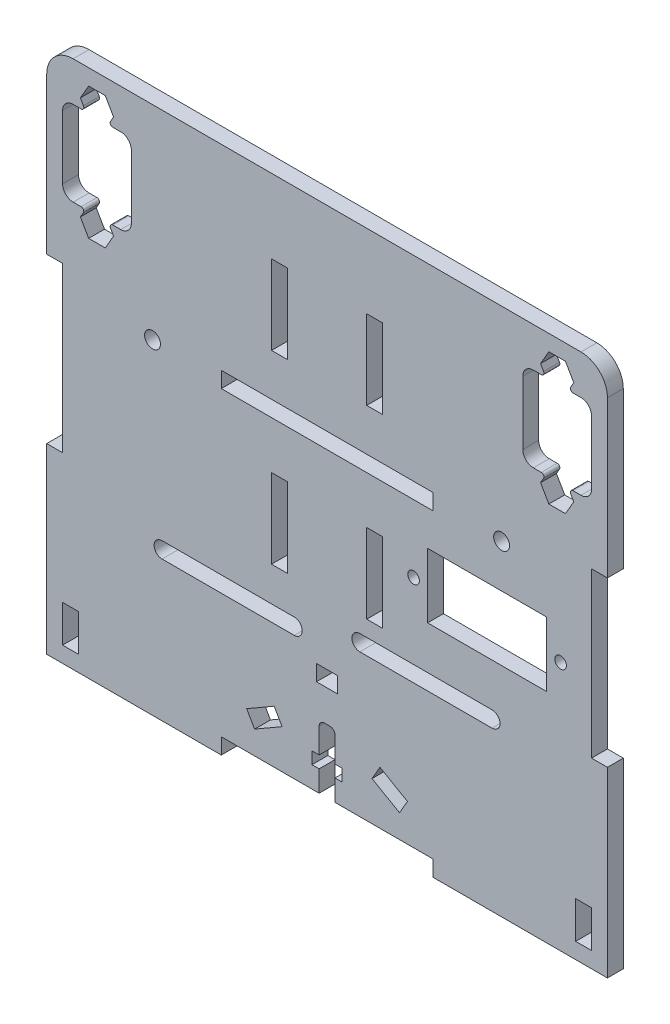
from build123d import *

# Parameters (mm, degrees)
ESBO_O1_W                  = 100
ESBO_O1_H                  = 100
RESSALTO_EXTRUS_O1_DEPTH   = 1.5
ESBO_O2_R                  = 1.5
ESBO_O2_W                  = 40
ESBO_O2_H                  = 3
CORTE_EXTRUS_O1_DEPTH      = 71.774289117
ESBO_O3_W                  = 3
ESBO_O3_H                  = 34.5
RESSALTO_EXTRUS_O2_DEPTH   = 3
CUT_EXTRUDE4_DEPTH         = 73.878323252
CUT_EXTRUDE4_DEPTH_BACK    = 73.878323252
FILLET1_R                  = 5
CUT_EXTRUDE5_DEPTH         = 73.878323252
CUT_EXTRUDE5_DEPTH_BACK    = 73.878323252
SKETCH3_W                  = 3
SKETCH3_H                  = 15
SKETCH3_W_2                = 4
SKETCH3_H_2                = 3
SKETCH3_H_3                = 7
CORTE_GY_VL53L0_DEPTH      = 73.924618614
CORTE_GY_VL53L0_DEPTH_BACK = 73.924618614
CUT_EXTRUDE6_DEPTH         = 73.924618614
CUT_EXTRUDE6_DEPTH_BACK    = 73.924618614
SKETCH4_R                  = 1.1
SKETCH4_W                  = 22.5
SKETCH4_H                  = 12.2
CUT_EXTRUDE7_DEPTH         = 73.924618614
CUT_EXTRUDE7_DEPTH_BACK    = 73.924618614


with BuildPart() as part:
    # Esboço1 → Ressalto-extrusão1 (new, symmetric)
    with BuildSketch(Plane.XY):
        Rectangle(ESBO_O1_W, ESBO_O1_H)
    extrude(amount=RESSALTO_EXTRUS_O1_DEPTH, both=True)

    # Esboço2 → Corte-extrusão1 (cut, through all)
    with BuildSketch(Plane.XY.offset(1.5)):
        with Locations((-33, 11.5)):
            Circle(ESBO_O2_R)
        with Locations(Location((33, 11.5, 0), (0, 0, 180))):
            Circle(ESBO_O2_R)
        with Locations((0, -48.5)):
            Rectangle(ESBO_O2_W, ESBO_O2_H)
        with Locations((0, 11.5)):
            Rectangle(ESBO_O2_W, ESBO_O2_H)
    extrude(amount=-CORTE_EXTRUS_O1_DEPTH, mode=Mode.SUBTRACT)

    # Esboço3 → Ressalto-extrusão2 (add, through all)
    with BuildSketch(Plane.XY.offset(1.5)):
        with Locations((-51.5, -32.75)):
            Rectangle(ESBO_O3_W, ESBO_O3_H)
        with Locations((51.5, -32.75)):
            Rectangle(ESBO_O3_W, ESBO_O3_H)
        with Locations((-51.5, 32.75)):
            Rectangle(ESBO_O3_W, ESBO_O3_H)
        with Locations((51.5, 32.75)):
            Rectangle(ESBO_O3_W, ESBO_O3_H)
    extrude(amount=-RESSALTO_EXTRUS_O2_DEPTH)

    # Sketch2 → Cut-Extrude4 (cut, two sides: drawn at the far end of the back side and taken through both)
    with BuildSketch(Plane.XY.offset(-CUT_EXTRUDE4_DEPTH_BACK)):
        with BuildLine():
            Line((-0.5, -35), (0.5, -35))
            ThreePointArc((0.5, -35), (1.207106781, -35.292893219), (1.5, -36))
            Line((1.5, -36), (1.5, -40.73))
            Line((1.5, -40.73), (2.85, -40.73))
            Line((2.85, -40.73), (2.85, -43))
            Line((2.85, -43), (1.5, -43))
            Line((1.5, -43), (1.5, -47))
            Line((1.5, -47), (-1.5, -47))
            Line((-1.5, -47), (-1.5, -43))
            Line((-1.5, -43), (-2.85, -43))
            Line((-2.85, -43), (-2.85, -40.73))
            Line((-2.85, -40.73), (-1.5, -40.73))
            Line((-1.5, -40.73), (-1.5, -36))
            ThreePointArc((-1.5, -36), (-1.207106781, -35.292893219), (-0.5, -35))
        make_face()
    extrude(amount=CUT_EXTRUDE4_DEPTH + CUT_EXTRUDE4_DEPTH_BACK, mode=Mode.SUBTRACT)

    # Fillet1
    fillet1_edges = [part.edges().sort_by_distance(p)[0] for p in [
        (53, 50, 0),
        (-53, 50, 0),
    ]]
    fillet(fillet1_edges, radius=FILLET1_R)

    # Sketch3 → Cut-Extrude5 (cut, two sides: drawn at the far end of the back side and taken through both)
    with BuildSketch(Plane.XY.offset(-CUT_EXTRUDE5_DEPTH_BACK)):
        with Locations((9, -6.5)):
            Rectangle(SKETCH3_W, SKETCH3_H)
        with Locations((9, 28.5)):
            Rectangle(SKETCH3_W, SKETCH3_H)
        with Locations((-9, 28.5)):
            Rectangle(SKETCH3_W, SKETCH3_H)
        with Locations((-9, -6.5)):
            Rectangle(SKETCH3_W, SKETCH3_H)
        with Locations((0, -27.5)):
            Rectangle(SKETCH3_W_2, SKETCH3_H_2)
        Polygon((-15.196152423, -40), (-10, -37), (-8.5, -39.598076211), (-13.696152423, -42.598076211), align=None)
        Polygon((10, -37), (8.5, -39.598076211), (13.696152423, -42.598076211), (15.196152423, -40), align=None)
        with Locations((-48.5, -43.5)):
            Rectangle(SKETCH3_W, SKETCH3_H_3)
        with Locations((48.5, -43.5)):
            Rectangle(SKETCH3_W, SKETCH3_H_3)
    extrude(amount=CUT_EXTRUDE5_DEPTH + CUT_EXTRUDE5_DEPTH_BACK, mode=Mode.SUBTRACT)

    # Sketch1 → Corte Gy-VL53L0 (cut, two sides: drawn at the far end of the back side and taken through both)
    with BuildSketch(Plane(origin=(0, 0, -1.5), x_dir=(-1, 0, 0), z_dir=(0, 0, -1)).offset(-CORTE_GY_VL53L0_DEPTH_BACK)):
        with BuildLine():
            Line((-46.5, 42.530680232), (-46.495662433, 42.530680232))
            ThreePointArc((-46.495662433, 42.530680232), (-46.062649731, 42.780680232), (-46.062649731, 43.280680232))
            Line((-46.062649731, 43.280680232), (-46.64, 44.280680232))
            Line((-46.64, 44.280680232), (-45.07, 47))
            Line((-45.07, 47), (-41.93, 47))
            Line((-41.93, 47), (-40.36, 44.280680232))
            Line((-40.36, 44.280680232), (-40.937350269, 43.280680232))
            ThreePointArc((-40.937350269, 43.280680232), (-40.937350269, 42.780680232), (-40.504337567, 42.530680232))
            Line((-40.504337567, 42.530680232), (-39, 42.530680232))
            ThreePointArc((-39, 42.530680232), (-37.585786438, 41.944893794), (-37, 40.530680232))
            Line((-37, 40.530680232), (-37, 28.530680232))
            ThreePointArc((-37, 28.530680232), (-37.585786438, 27.11646667), (-39, 26.530680232))
            Line((-39, 26.530680232), (-40.504337567, 26.530680232))
            ThreePointArc((-40.504337567, 26.530680232), (-40.937350269, 26.280680232), (-40.937350269, 25.780680232))
            Line((-40.937350269, 25.780680232), (-40.36, 24.780680232))
            Line((-40.36, 24.780680232), (-41.93, 22.061360464))
            Line((-41.93, 22.061360464), (-45.07, 22.061360464))
            Line((-45.07, 22.061360464), (-46.64, 24.780680232))
            Line((-46.64, 24.780680232), (-46.062649731, 25.780680232))
            ThreePointArc((-46.062649731, 25.780680232), (-46.062649731, 26.280680232), (-46.495662433, 26.530680232))
            Line((-46.495662433, 26.530680232), (-48, 26.530680232))
            ThreePointArc((-48, 26.530680232), (-49.414213562, 27.11646667), (-50, 28.530680232))
            Line((-50, 28.530680232), (-50, 34.530680232))
            Line((-50, 34.530680232), (-50, 40.530680232))
            ThreePointArc((-50, 40.530680232), (-49.414213562, 41.944893794), (-48, 42.530680232))
            Line((-48, 42.530680232), (-46.5, 42.530680232))
        make_face()
        with BuildLine():
            Line((46.5, 42.530680232), (46.495662433, 42.530680232))
            ThreePointArc((46.495662433, 42.530680232), (46.062649731, 42.780680232), (46.062649731, 43.280680232))
            Line((46.062649731, 43.280680232), (46.64, 44.280680232))
            Line((46.64, 44.280680232), (45.07, 47))
            Line((45.07, 47), (41.93, 47))
            Line((41.93, 47), (40.36, 44.280680232))
            Line((40.36, 44.280680232), (40.937350269, 43.280680232))
            ThreePointArc((40.937350269, 43.280680232), (40.937350269, 42.780680232), (40.504337567, 42.530680232))
            Line((40.504337567, 42.530680232), (39, 42.530680232))
            ThreePointArc((39, 42.530680232), (37.585786438, 41.944893794), (37, 40.530680232))
            Line((37, 40.530680232), (37, 28.530680232))
            ThreePointArc((37, 28.530680232), (37.585786438, 27.11646667), (39, 26.530680232))
            Line((39, 26.530680232), (40.504337567, 26.530680232))
            ThreePointArc((40.504337567, 26.530680232), (40.937350269, 26.280680232), (40.937350269, 25.780680232))
            Line((40.937350269, 25.780680232), (40.36, 24.780680232))
            Line((40.36, 24.780680232), (41.93, 22.061360464))
            Line((41.93, 22.061360464), (45.07, 22.061360464))
            Line((45.07, 22.061360464), (46.64, 24.780680232))
            Line((46.64, 24.780680232), (46.062649731, 25.780680232))
            ThreePointArc((46.062649731, 25.780680232), (46.062649731, 26.280680232), (46.495662433, 26.530680232))
            Line((46.495662433, 26.530680232), (48, 26.530680232))
            ThreePointArc((48, 26.530680232), (49.414213562, 27.11646667), (50, 28.530680232))
            Line((50, 28.530680232), (50, 34.530680232))
            Line((50, 34.530680232), (50, 40.530680232))
            ThreePointArc((50, 40.530680232), (49.414213562, 41.944893794), (48, 42.530680232))
            Line((48, 42.530680232), (46.5, 42.530680232))
        make_face()
    extrude(amount=CORTE_GY_VL53L0_DEPTH + CORTE_GY_VL53L0_DEPTH_BACK, mode=Mode.SUBTRACT)

    # Sketch4 → Cut-Extrude6 (cut, two sides: drawn at the far end of the back side and taken through both)
    with BuildSketch(Plane.XY.offset(1.5).offset(-CUT_EXTRUDE6_DEPTH_BACK)):
        with Locations((44.15, -2.75)):
            Circle(SKETCH4_R)
        with Locations((16.35, -2.75)):
            Circle(SKETCH4_R)
        with Locations((30.25, -2.75)):
            Rectangle(SKETCH4_W, SKETCH4_H)
    extrude(amount=CUT_EXTRUDE6_DEPTH + CUT_EXTRUDE6_DEPTH_BACK, mode=Mode.SUBTRACT)

    # Sketch6 → Cut-Extrude7 (cut, two sides: drawn at the far end of the back side and taken through both)
    with BuildSketch(Plane.XY.offset(1.5).offset(-CUT_EXTRUDE7_DEPTH_BACK)):
        with BuildLine():
            Line((-31.2, -20.5), (-6.2, -20.5))
            ThreePointArc((-6.2, -20.5), (-4.7, -22), (-6.2, -23.5))
            Line((-6.2, -23.5), (-31.2, -23.5))
            ThreePointArc((-31.2, -23.5), (-32.7, -22), (-31.2, -20.5))
        make_face()
        with BuildLine():
            Line((6.2, -17), (31.2, -17))
            ThreePointArc((31.2, -17), (32.7, -18.5), (31.2, -20))
            Line((31.2, -20), (6.2, -20))
            ThreePointArc((6.2, -20), (4.7, -18.5), (6.2, -17))
        make_face()
    extrude(amount=CUT_EXTRUDE7_DEPTH + CUT_EXTRUDE7_DEPTH_BACK, mode=Mode.SUBTRACT)


solid = part.part
